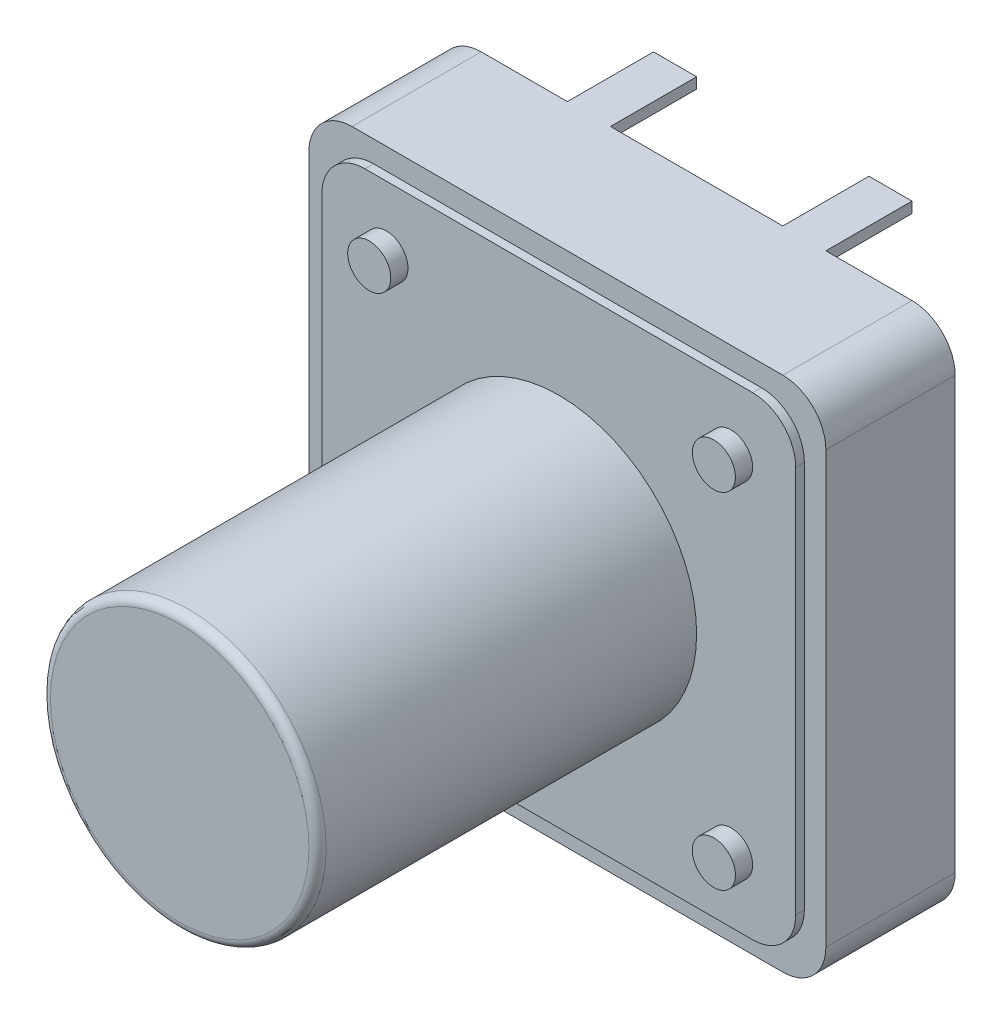
from build123d import *

# Parameters (mm, degrees)
EXTRUDE_1_DEPTH = 3
SKETCH_2_R      = 3.2
EXTRUDE_2_DEPTH = 9
FILLET_1_R      = 0.2
EXTRUDE_3_DEPTH = 0.2
SKETCH_4_R      = 0.5
EXTRUDE_4_DEPTH = 0.4
SKETCH_5_W      = 1
SKETCH_5_H      = 0.25
EXTRUDE_5_DEPTH = 2


with BuildPart() as part:
    # 草图1 → 凸台-拉伸1 (new body)
    with BuildSketch(Plane.XY):
        with BuildLine():
            Line((1, 0), (11, 0))
            ThreePointArc((11, 0), (11.707106781, -0.292893219), (12, -1))
            Line((12, -1), (12, -11))
            ThreePointArc((12, -11), (11.707106781, -11.707106781), (11, -12))
            Line((11, -12), (1, -12))
            ThreePointArc((1, -12), (0.292893219, -11.707106781), (0, -11))
            Line((0, -11), (0, -1))
            ThreePointArc((0, -1), (0.292893219, -0.292893219), (1, 0))
        make_face()
    extrude(amount=EXTRUDE_1_DEPTH)

    # 草图2 → 凸台-拉伸2 (add)
    with BuildSketch(Plane.XY.offset(3)):
        with Locations(Location((6, -6, 0), (0, 0, 180))):
            Circle(SKETCH_2_R)
    extrude(amount=EXTRUDE_2_DEPTH)

    # 圆角1
    fillet_1_edges = [part.edges().sort_by_distance(p)[0] for p in [
        (9.2, -6, 12),
    ]]
    fillet(fillet_1_edges, radius=FILLET_1_R)

    # 草图3 → 凸台-拉伸3 (add)
    with BuildSketch(Plane.XY.offset(3)):
        with BuildLine():
            Line((1.5, -0.5), (10.5, -0.5))
            ThreePointArc((10.5, -0.5), (11.207106781, -0.792893219), (11.5, -1.5))
            Line((11.5, -1.5), (11.5, -10.5))
            ThreePointArc((11.5, -10.5), (11.207106781, -11.207106781), (10.5, -11.5))
            Line((10.5, -11.5), (1.5, -11.5))
            ThreePointArc((1.5, -11.5), (0.792893219, -11.207106781), (0.5, -10.5))
            Line((0.5, -10.5), (0.5, -1.5))
            ThreePointArc((0.5, -1.5), (0.792893219, -0.792893219), (1.5, -0.5))
        make_face()
    extrude(amount=EXTRUDE_3_DEPTH)

    # 草图4 → 凸台-拉伸4 (add)
    with BuildSketch(Plane.XY.offset(3.2)):
        with Locations((2, -2)):
            Circle(SKETCH_4_R)
        with Locations(Location((10, -2, 0), (0, 0, 180))):
            Circle(SKETCH_4_R)
        with Locations((10, -10)):
            Circle(SKETCH_4_R)
        with Locations(Location((2, -10, 0), (0, 0, 180))):
            Circle(SKETCH_4_R)
    extrude(amount=EXTRUDE_4_DEPTH)

    # 草图5 → 凸台-拉伸5 (add)
    with BuildSketch(Plane(origin=(0, 0, 0), x_dir=(-1, 0, 0), z_dir=(0, 0, -1))):
        with Locations((-3.5, -11.875)):
            Rectangle(SKETCH_5_W, SKETCH_5_H)
        with Locations((-8.5, -11.875)):
            Rectangle(SKETCH_5_W, SKETCH_5_H)
        with Locations((-8.5, -0.125)):
            Rectangle(SKETCH_5_W, SKETCH_5_H)
        with Locations((-3.5, -0.125)):
            Rectangle(SKETCH_5_W, SKETCH_5_H)
    extrude(amount=EXTRUDE_5_DEPTH)


solid = part.part
